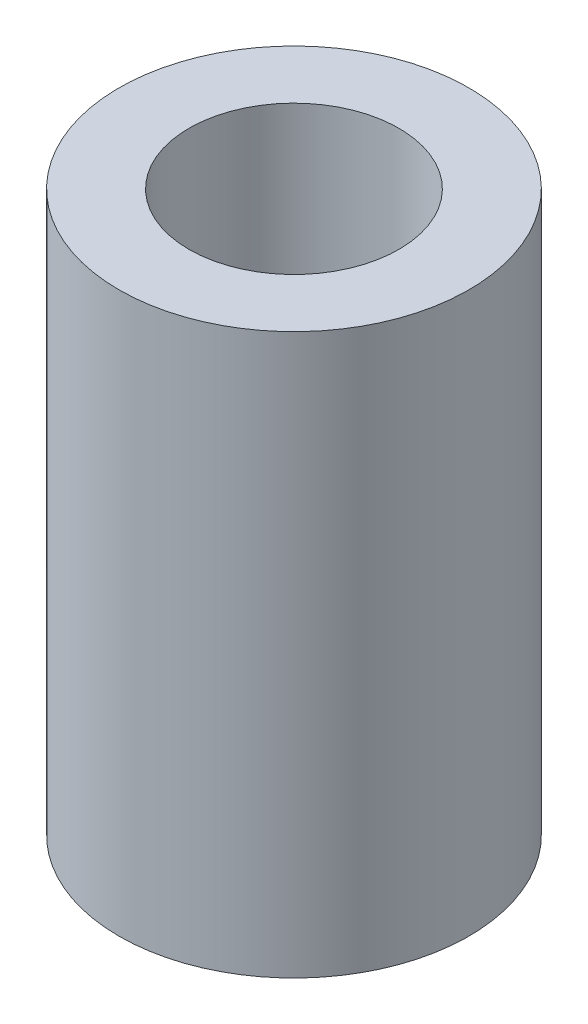
from build123d import *

# Parameters (mm, degrees)
SKETCH1_R           = 2.5
SKETCH1_R_2         = 1.5
BOSS_EXTRUDE1_DEPTH = 8


with BuildPart() as part:
    # Sketch1 → Boss-Extrude1 (new body)
    with BuildSketch(Plane(origin=(0, 0, 0), x_dir=(1, 0, 0), z_dir=(0, 1, 0))):
        with Locations(Location((0, 0, 0), (0, 0, 270))):
            Circle(SKETCH1_R)
        with Locations(Location((0, 0, 0), (0, 0, 270))):
            Circle(SKETCH1_R_2, mode=Mode.SUBTRACT)
    extrude(amount=BOSS_EXTRUDE1_DEPTH)


solid = part.part
